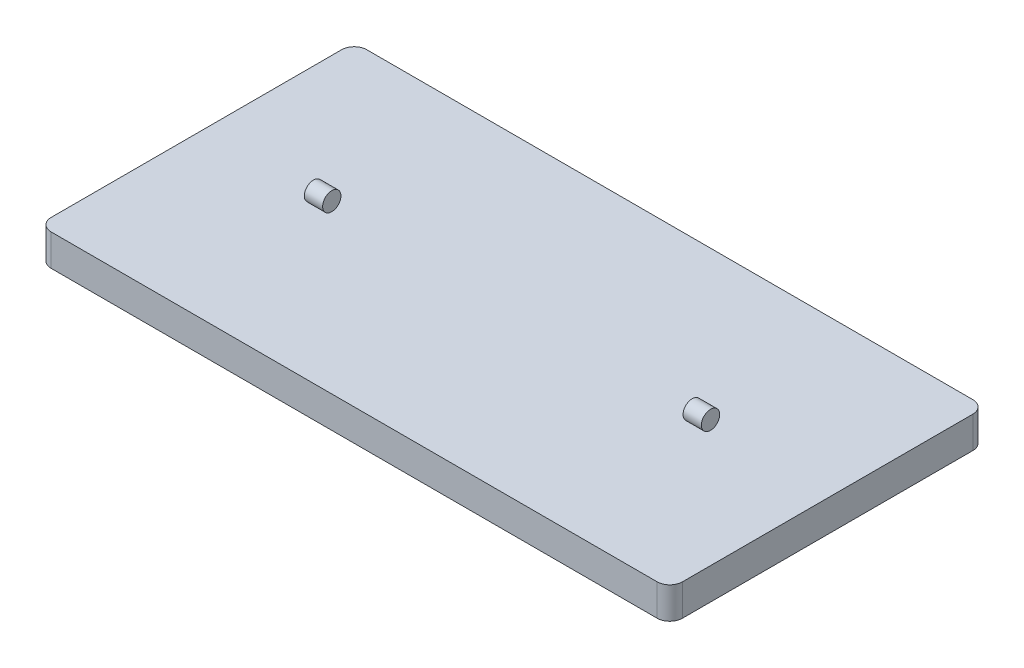
from build123d import *

# Parameters (mm, degrees)
SKETCH1_W                = 500
SKETCH1_H                = 250
BOSS_EXTRUDE1_DEPTH      = 25
FILLET1_R                = 10
BOSS_EXTRUDE2_DEPTH      = 7.25
BOSS_EXTRUDE2_DEPTH_BACK = 7.25
SKETCH5_R                = 7.25


with BuildPart() as part:
    # Sketch1 → Boss-Extrude1 (new body)
    with BuildSketch(Plane(origin=(0, 0, 0), x_dir=(1, 0, 0), z_dir=(0, 1, 0))):
        Rectangle(SKETCH1_W, SKETCH1_H)
    extrude(amount=BOSS_EXTRUDE1_DEPTH)

    # Fillet1
    fillet1_edges = [part.edges().sort_by_distance(p)[0] for p in [
        (-250, 12.5, -125),
        (250, 12.5, -125),
        (250, 12.5, 125),
        (-250, 12.5, 125),
    ]]
    fillet(fillet1_edges, radius=FILLET1_R)


with BuildPart() as body_2:
    # Sketch5 → Boss-Extrude2 (new, two sides: drawn at the far end of the back side and taken through both)
    with BuildSketch(Plane(origin=(150, 0, 0), x_dir=(0, 0, -1), z_dir=(1, 0, 0)).offset(-BOSS_EXTRUDE2_DEPTH_BACK)):
        with Locations((0, 32.25)):
            Circle(SKETCH5_R)
    extrude(amount=BOSS_EXTRUDE2_DEPTH + BOSS_EXTRUDE2_DEPTH_BACK)


with BuildPart() as body_3:
    # Mirror3: mirrored copy
    add(body_2.part.mirror(Plane(origin=(0, 0, 0), x_dir=(0, 0, 1), z_dir=(1, 0, 0))))


solid = Compound([part.part, body_2.part, body_3.part])
